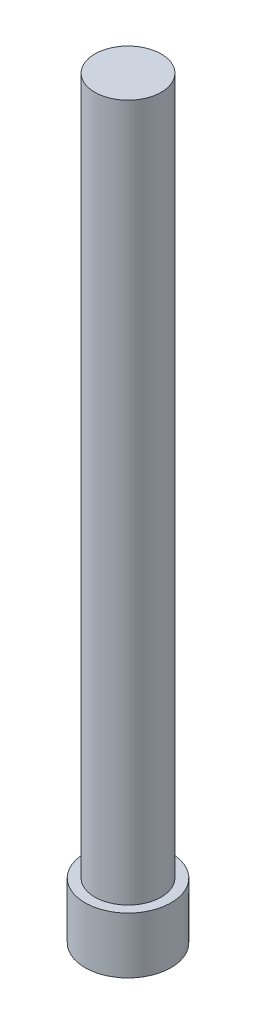
from build123d import *

# Parameters (mm, degrees)
SKETCH1_R           = 0.750000024
BOSS_EXTRUDE1_DEPTH = 15.748
SKETCH3_R           = 0.971513934
BOSS_EXTRUDE3_DEPTH = 1.27


with BuildPart() as part:
    # Sketch1 → Boss-Extrude1 (new body)
    with BuildSketch(Plane(origin=(0, 0, 0), x_dir=(1, 0, 0), z_dir=(0, 1, 0))):
        with Locations(Location((0, 0, 0), (0, 0, 270))):
            Circle(SKETCH1_R)
    extrude(amount=BOSS_EXTRUDE1_DEPTH)

    # Sketch3 → Boss-Extrude3 (add)
    with BuildSketch(Plane.XZ):
        with Locations(Location((0, 0, 0), (0, 0, 270))):
            Circle(SKETCH3_R)
    extrude(amount=BOSS_EXTRUDE3_DEPTH)


solid = part.part
